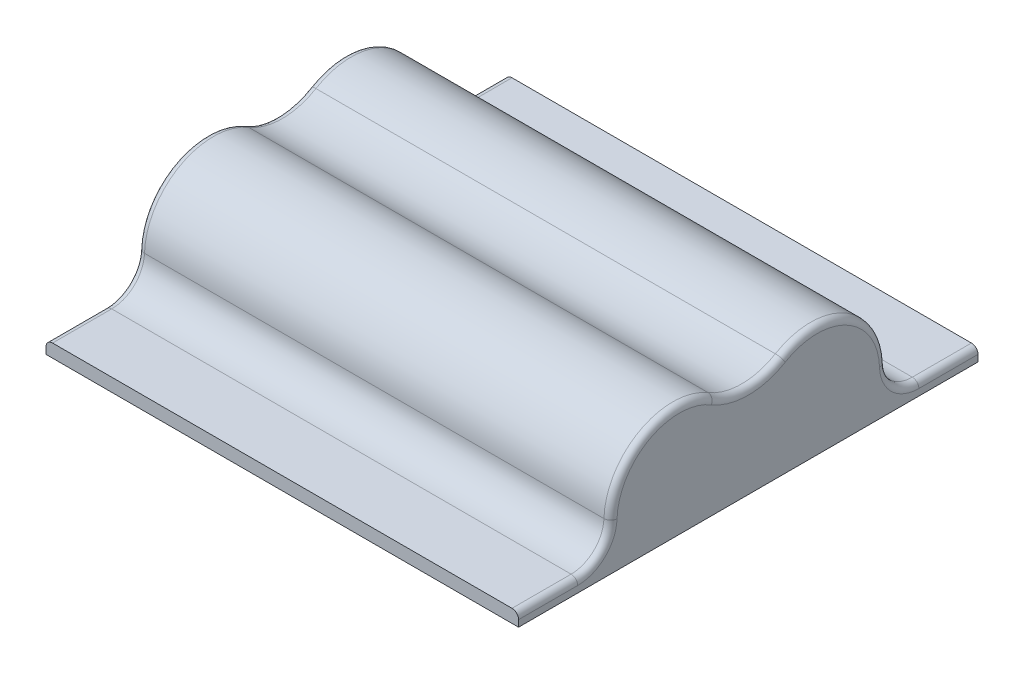
from build123d import *

# Parameters (mm, degrees)
SKETCH1_W                = 72
SKETCH1_H                = 70
BOSS_EXTRUDE1_DEPTH      = 2
BOSS_EXTRUDE2_DEPTH      = 34
BOSS_EXTRUDE2_DEPTH_BACK = 34
CUT_EXTRUDE1_START       = -34
SKETCH3_W                = 39.5
SKETCH3_H                = 2
CUT_EXTRUDE1_DEPTH       = 68
BOSS_EXTRUDE3_DEPTH      = 2
FILLET2_R                = 1
FILLET2_OF_MIRROR1_R     = 1


with BuildPart() as part:
    # Sketch1 → Boss-Extrude1 (new body)
    with BuildSketch(Plane(origin=(0, 0, 0), x_dir=(1, 0, 0), z_dir=(0, 1, 0))):
        Rectangle(SKETCH1_W, SKETCH1_H)
    extrude(amount=BOSS_EXTRUDE1_DEPTH)

    # Sketch2 → Boss-Extrude2 (add, two sides: drawn at the far end of the back side and taken through both)
    with BuildSketch(Plane(origin=(0, 0, 0), x_dir=(0, 0, -1), z_dir=(1, 0, 0)).offset(-BOSS_EXTRUDE2_DEPTH_BACK)):
        with BuildLine():
            Line((-25.991933385, 2), (-19.75, 2))
            Line((-19.75, 2), (-19.75, 6.5))
            ThreePointArc((-19.75, 6.5), (-13.763212024, 15.155284356), (-3.552389776, 12.606816862))
            Line((-3.552389776, 12.606816862), (3.552389776, 12.606816862))
            ThreePointArc((3.552389776, 12.606816862), (13.763212024, 15.155284356), (19.75, 6.5))
            Line((19.75, 6.5), (19.75, 2))
            Line((19.75, 2), (25.991933385, 2))
            ThreePointArc((25.991933385, 2), (22.513891667, 3.407893959), (20.994535519, 6.838709677))
            ThreePointArc((20.994535519, 6.838709677), (15.537625909, 15.712617717), (5.12195122, 15.51812571))
            ThreePointArc((5.12195122, 15.51812571), (0, 14.106816862), (-5.12195122, 15.51812571))
            ThreePointArc((-5.12195122, 15.51812571), (-15.537625909, 15.712617717), (-20.994535519, 6.838709677))
            ThreePointArc((-20.994535519, 6.838709677), (-22.513891667, 3.407893959), (-25.991933385, 2))
        make_face()
    extrude(amount=BOSS_EXTRUDE2_DEPTH + BOSS_EXTRUDE2_DEPTH_BACK)

    # Sketch3 → Cut-Extrude1 (cut)
    with BuildSketch(Plane(origin=(0, 0, 0), x_dir=(0, 0, -1), z_dir=(1, 0, 0)).offset(CUT_EXTRUDE1_START)):
        with Locations((0, 1)):
            Rectangle(SKETCH3_W, SKETCH3_H)
    extrude(amount=CUT_EXTRUDE1_DEPTH, mode=Mode.SUBTRACT)

    # Sketch4 → Boss-Extrude3 (add)
    with BuildSketch(Plane(origin=(34, 0, 0), x_dir=(0, 0, -1), z_dir=(1, 0, 0))):
        with BuildLine():
            Line((-25.991933385, 2), (25.991933385, 2))
            ThreePointArc((25.991933385, 2), (22.513891667, 3.407893959), (20.994535519, 6.838709677))
            ThreePointArc((20.994535519, 6.838709677), (15.537625909, 15.712617717), (5.12195122, 15.51812571))
            ThreePointArc((5.12195122, 15.51812571), (0, 14.106816862), (-5.12195122, 15.51812571))
            ThreePointArc((-5.12195122, 15.51812571), (-15.537625909, 15.712617717), (-20.994535519, 6.838709677))
            ThreePointArc((-20.994535519, 6.838709677), (-22.513891667, 3.407893959), (-25.991933385, 2))
        make_face()
    boss_extrude3 = extrude(amount=BOSS_EXTRUDE3_DEPTH)

    # Fillet2
    fillet2_edges = [part.edges().sort_by_distance(p)[0] for p in [
        (36, 2, 30.495966692),
        (36, 2, -30.495966692),
        (36, 3.407893959, -22.513891667),
        (36, 15.712617717, -15.537625909),
        (36, 14.106816862, 0),
        (36, 15.712617717, 15.537625909),
        (36, 3.407893959, 22.513891667),
    ]]
    fillet(fillet2_edges, radius=FILLET2_R)

    # Mirror1: Boss-Extrude3 across plane
    add(boss_extrude3.mirror(Plane(origin=(0, 0, 0), x_dir=(0, 0, 1), z_dir=(1, 0, 0))))

    # Fillet2 of Mirror1
    fillet2_of_mirror1_edges = [part.edges().sort_by_distance(p)[0] for p in [
        (-36, 2, 30.495966692),
        (-36, 2, -30.495966692),
        (-36, 3.407893959, -22.513891667),
        (-36, 15.712617717, -15.537625909),
        (-36, 14.106816862, 0),
        (-36, 15.712617717, 15.537625909),
        (-36, 3.407893959, 22.513891667),
    ]]
    fillet(fillet2_of_mirror1_edges, radius=FILLET2_OF_MIRROR1_R)


solid = part.part
